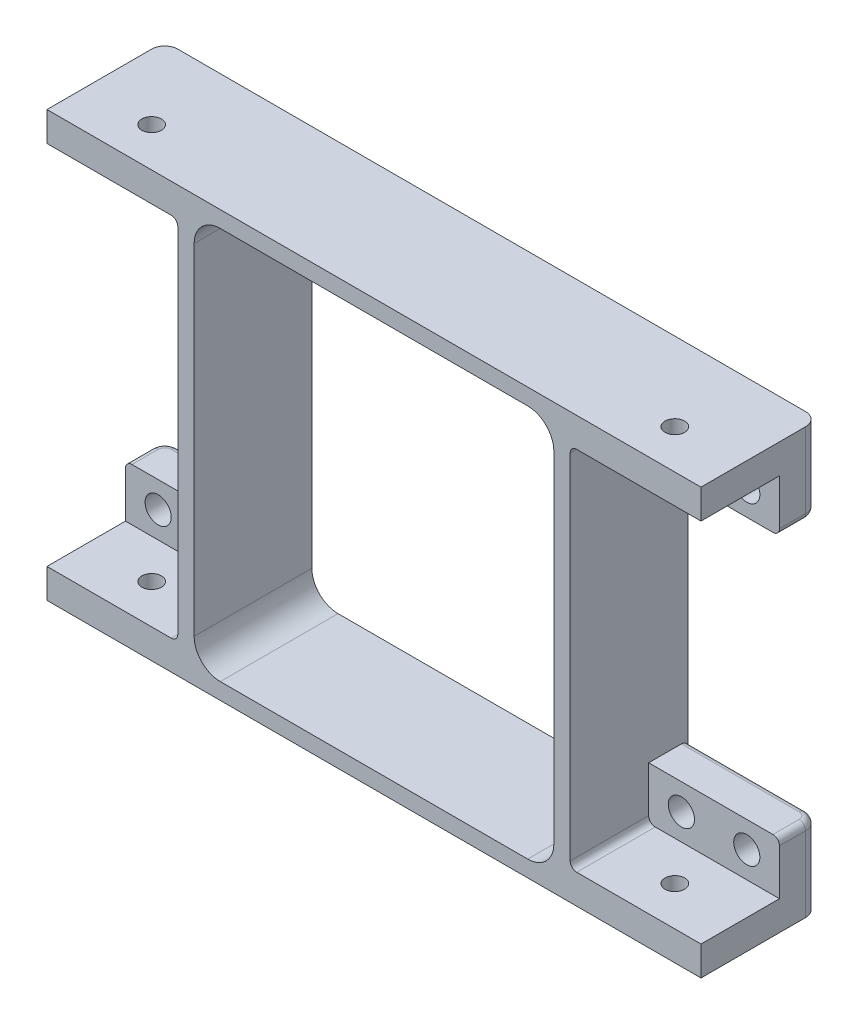
from build123d import *

# Parameters (mm, degrees)
SKETCH_1_W          = 100
SKETCH_1_H          = 65
EXTRUDE_1_DEPTH     = 18
SKETCH_2_W          = 55
SKETCH_2_H          = 60
CUT_EXTRUDE_1_DEPTH = 63.291652731
SKETCH_3_W          = 20
SKETCH_3_H          = 56
CUT_EXTRUDE_2_DEPTH = 12
SKETCH_4_W          = 20
SKETCH_4_H          = 40
CUT_EXTRUDE_3_DEPTH = 61.829680256
SKETCH_5_R          = 2
CUT_EXTRUDE_4_DEPTH = 61.829680256
SKETCH_6_R          = 1.5
CUT_EXTRUDE_5_DEPTH = 84.958322994
FILLET_1_R          = 4
FILLET_2_R          = 2
FILLET_3_R          = 1


with BuildPart() as part:
    # 草图1 → 凸台-拉伸1 (new body)
    with BuildSketch(Plane.XY):
        Rectangle(SKETCH_1_W, SKETCH_1_H)
    extrude(amount=EXTRUDE_1_DEPTH)

    # 草图2 → 切除-拉伸1 (cut, through all)
    with BuildSketch(Plane.XY.offset(18)):
        Rectangle(SKETCH_2_W, SKETCH_2_H)
    extrude(amount=-CUT_EXTRUDE_1_DEPTH, mode=Mode.SUBTRACT)

    # 草图3 → 切除-拉伸2 (cut)
    with BuildSketch(Plane.XY.offset(18)):
        with Locations((40, 0)):
            Rectangle(SKETCH_3_W, SKETCH_3_H)
    cut_extrude_2 = extrude(amount=-CUT_EXTRUDE_2_DEPTH, mode=Mode.SUBTRACT)

    # 草图4 → 切除-拉伸3 (cut, through all)
    with BuildSketch(Plane.XY.offset(6)):
        with Locations((40, 0)):
            Rectangle(SKETCH_4_W, SKETCH_4_H)
    cut_extrude_3 = extrude(amount=-CUT_EXTRUDE_3_DEPTH, mode=Mode.SUBTRACT)

    # 草图5 → 切除-拉伸4 (cut, through all)
    with BuildSketch(Plane.XY.offset(6)):
        with Locations((45, 24)):
            Circle(SKETCH_5_R)
        with Locations((35, 24)):
            Circle(SKETCH_5_R)
        with Locations(Location((35, -24, 0), (0, 0, 180))):
            Circle(SKETCH_5_R)
        with Locations(Location((45, -24, 0), (0, 0, 180))):
            Circle(SKETCH_5_R)
    cut_extrude_4 = extrude(amount=-CUT_EXTRUDE_4_DEPTH, mode=Mode.SUBTRACT)

    # 草图6 → 切除-拉伸5 (cut, through all)
    with BuildSketch(Plane(origin=(0, 32.5, 0), x_dir=(1, 0, 0), z_dir=(0, 1, 0))):
        with Locations(Location((40, -12, 0), (0, 0, 270))):
            Circle(SKETCH_6_R)
    cut_extrude_5 = extrude(amount=-CUT_EXTRUDE_5_DEPTH, mode=Mode.SUBTRACT)

    # 镜向1: 切除-拉伸2, 切除-拉伸3, 切除-拉伸4, 切除-拉伸5 across plane
    add(cut_extrude_2.mirror(Plane(origin=(0, 0, 0), x_dir=(0, 0, 1), z_dir=(1, 0, 0))), mode=Mode.SUBTRACT)
    add(cut_extrude_3.mirror(Plane(origin=(0, 0, 0), x_dir=(0, 0, 1), z_dir=(1, 0, 0))), mode=Mode.SUBTRACT)
    add(cut_extrude_4.mirror(Plane(origin=(0, 0, 0), x_dir=(0, 0, 1), z_dir=(1, 0, 0))), mode=Mode.SUBTRACT)
    add(cut_extrude_5.mirror(Plane(origin=(0, 0, 0), x_dir=(0, 0, 1), z_dir=(1, 0, 0))), mode=Mode.SUBTRACT)

    # 圆角1
    fillet_1_edges = [part.edges().sort_by_distance(p)[0] for p in [
        (27.5, 30, 9),
        (27.5, -30, 9),
        (-27.5, -30, 9),
        (-27.5, 30, 9),
    ]]
    fillet(fillet_1_edges, radius=FILLET_1_R)

    # 圆角2
    fillet_2_edges = [part.edges().sort_by_distance(p)[0] for p in [
        (50, 26.25, 0),
        (-50, 26.25, 0),
        (50, -26.25, 0),
        (-50, -26.25, 0),
    ]]
    fillet(fillet_2_edges, radius=FILLET_2_R)

    # 圆角3
    fillet_3_edges = [part.edges().sort_by_distance(p)[0] for p in [
        (-39, -20, 0),
        (-50, -20, 4),
        (-39, 20, 0),
        (39, 20, 0),
        (-49.414213562, -20, 0.585786438),
        (-50, 20, 4),
        (-49.414213562, 20, 0.585786438),
        (50, -20, 4),
        (49.414213562, -20, 0.585786438),
        (50, 20, 4),
        (49.414213562, 20, 0.585786438),
        (30, 28, 12),
        (30, -28, 12),
        (39, -20, 0),
        (-30, 28, 12),
        (-30, -28, 12),
    ]]
    fillet(fillet_3_edges, radius=FILLET_3_R)


solid = part.part
